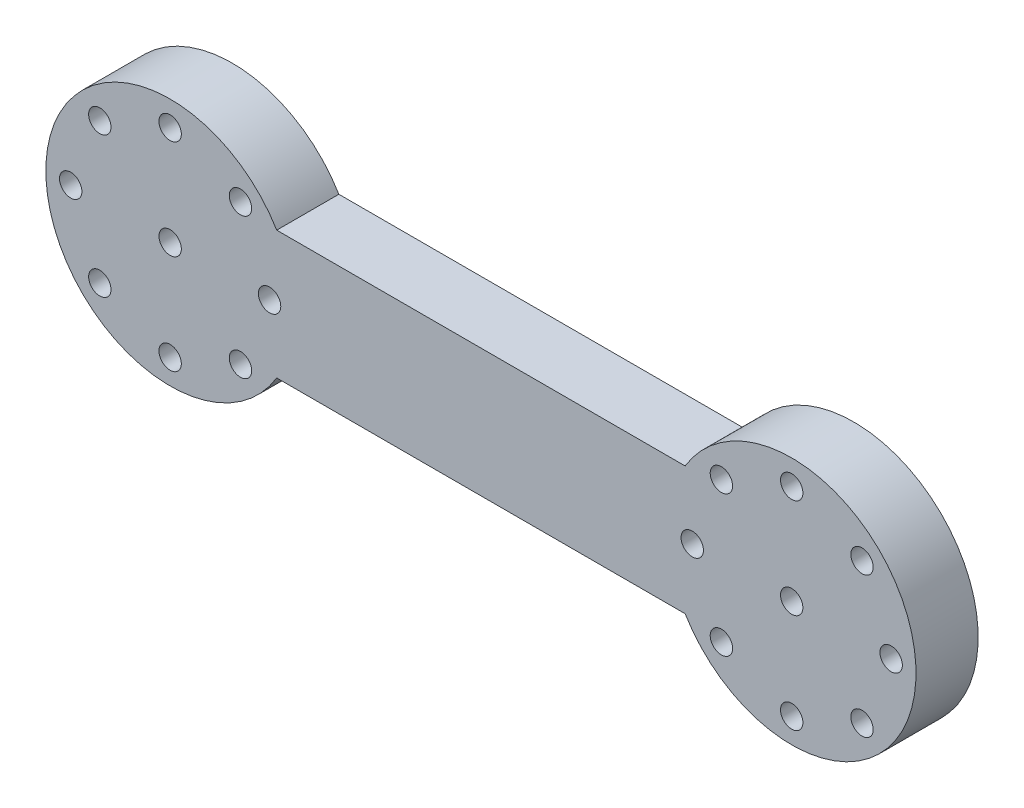
from build123d import *

# Parameters (mm, degrees)
ESQUISSE1_R             = 2.45
BOSS_EXTRU_1_DEPTH      = 5
BOSS_EXTRU_2_START      = -2.53
ESQUISSE2_R             = 2.45
ESQUISSE2_R_2           = 0.9
BOSS_EXTRU_2_DEPTH      = 2.53
BOSS_EXTRU_4_START      = -5
ESQUISSE4_R             = 10
ESQUISSE4_R_2           = 2.45
BOSS_EXTRU_4_DEPTH      = 5
ESQUISSE5_R             = 0.9
ENL_V_MAT_EXTRU_3_DEPTH = 10


with BuildPart() as part:
    # Esquisse1 → Boss.-Extru.1 (new body)
    with BuildSketch(Plane.XY):
        with BuildLine():
            Line((0, 5.147731849), (50, 5.147731849))
            ThreePointArc((50, 5.147731849), (55.147731849, 0), (50, -5.147731849))
            Line((50, -5.147731849), (0, -5.147731849))
            ThreePointArc((0, -5.147731849), (-5.147731849, 0), (0, 5.147731849))
        make_face()
        Circle(ESQUISSE1_R, mode=Mode.SUBTRACT)
        with Locations((50, 0)):
            Circle(ESQUISSE1_R, mode=Mode.SUBTRACT)
    extrude(amount=BOSS_EXTRU_1_DEPTH)

    # Esquisse2 → Boss.-Extru.2 (add)
    # profile 1 of 2: a face of its own
    with BuildSketch(Plane.XY.offset(5).offset(BOSS_EXTRU_2_START)):
        Circle(ESQUISSE2_R)
        Circle(ESQUISSE2_R_2, mode=Mode.SUBTRACT)
    # profile 2 of 2: a face of its own
    with BuildSketch(Plane.XY.offset(5).offset(BOSS_EXTRU_2_START)):
        with Locations(Location((50, 0, 0), (0, 0, 180))):
            Circle(ESQUISSE2_R)
        with Locations(Location((50, 0, 0), (0, 0, 180))):
            Circle(ESQUISSE2_R_2, mode=Mode.SUBTRACT)
    extrude(amount=BOSS_EXTRU_2_DEPTH)

    # Esquisse4 → Boss.-Extru.4 (add)
    # profile 1 of 2: a face of its own
    with BuildSketch(Plane.XY.offset(5).offset(BOSS_EXTRU_4_START)):
        Circle(ESQUISSE4_R)
        Circle(ESQUISSE4_R_2, mode=Mode.SUBTRACT)
    # profile 2 of 2: a face of its own
    with BuildSketch(Plane.XY.offset(5).offset(BOSS_EXTRU_4_START)):
        with Locations((50, 0)):
            Circle(ESQUISSE4_R)
        with Locations(Location((50, 0, 0), (0, 0, 180))):
            Circle(ESQUISSE4_R_2, mode=Mode.SUBTRACT)
    extrude(amount=BOSS_EXTRU_4_DEPTH)

    # Esquisse5 → Enlèv. mat.-Extru.3 (cut)
    with BuildSketch(Plane.XY.offset(5)):
        with Locations((-8, 0)):
            Circle(ESQUISSE5_R)
        with Locations((-5.656854249, 5.656854249)):
            Circle(ESQUISSE5_R)
        with Locations((0, 8)):
            Circle(ESQUISSE5_R)
        with Locations((5.656854249, 5.656854249)):
            Circle(ESQUISSE5_R)
        with Locations((8, 0)):
            Circle(ESQUISSE5_R)
        with Locations((5.656854249, -5.656854249)):
            Circle(ESQUISSE5_R)
        with Locations((0, -8)):
            Circle(ESQUISSE5_R)
        with Locations((-5.656854249, -5.656854249)):
            Circle(ESQUISSE5_R)
        with Locations((44.343145751, 5.656854249)):
            Circle(ESQUISSE5_R)
        with Locations((42, 0)):
            Circle(ESQUISSE5_R)
        with Locations((44.343145751, -5.656854249)):
            Circle(ESQUISSE5_R)
        with Locations((50, -8)):
            Circle(ESQUISSE5_R)
        with Locations((55.656854249, -5.656854249)):
            Circle(ESQUISSE5_R)
        with Locations((58, 0)):
            Circle(ESQUISSE5_R)
        with Locations((55.656854249, 5.656854249)):
            Circle(ESQUISSE5_R)
        with Locations((50, 8)):
            Circle(ESQUISSE5_R)
    extrude(amount=-ENL_V_MAT_EXTRU_3_DEPTH, mode=Mode.SUBTRACT)


solid = part.part
